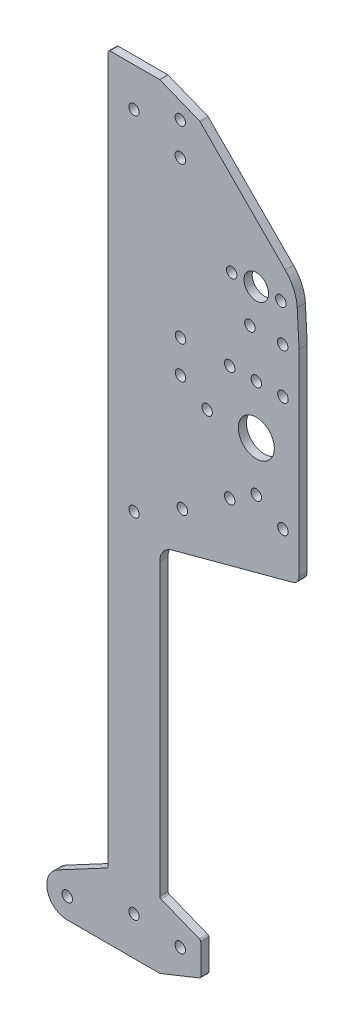
from build123d import *

# Parameters (mm, degrees)
SKETCH1_W               = 20
SKETCH1_H               = 300
BOSS_EXTRUDE1_DEPTH     = 3.175
SKETCH2_R               = 2
SKETCH2_R_2             = 2.032
BOSS_EXTRUDE2_DEPTH     = 3.175
SKETCH4_R               = 2
CUT_EXTRUDE1_DEPTH      = 153.248468794
SKETCH6_R               = 2.032
BOSS_EXTRUDE4_DEPTH     = 3.175
FILLET4_R               = 0.79375
SKETCH7_R               = 4.7625
SKETCH7_R_2             = 6.985
SKETCH7_R_3             = 2.032
BOSS_EXTRUDE5_DEPTH     = 3.175
SKETCH8_R               = 2.032
CUT_EXTRUDE2_DEPTH      = 164.103897102
CUT_EXTRUDE3_DEPTH      = 164.103897102
SKETCH10_R              = 2.032
CUT_EXTRUDE4_DEPTH      = 164.103897102
FILLET6_R               = 6.35
CUT_EXTRUDE5_DEPTH      = 164.103897102
CUT_EXTRUDE5_DEPTH_BACK = 164.103897102
SKETCH11_R              = 2
SKETCH12_R              = 2.032
BOSS_EXTRUDE6_DEPTH     = 3.175
FILLET7_R               = 0.79375


with BuildPart() as part:
    # Sketch1 → Boss-Extrude1 (new body)
    with BuildSketch(Plane.XY):
        Rectangle(SKETCH1_W, SKETCH1_H)
    extrude(amount=BOSS_EXTRUDE1_DEPTH)

    # Sketch2 → Boss-Extrude2 (add)
    # profile 1 of 2: a face of its own
    with BuildSketch(Plane.XY.offset(3.175)):
        Polygon((10, 150), (25.875, 143.65), (25.875, 124.6), (10, 118.25), align=None)
        with Locations((17.9375, 140.475)):
            Circle(SKETCH2_R, mode=Mode.SUBTRACT)
        with Locations((17.9375, 127.775)):
            Circle(SKETCH2_R_2, mode=Mode.SUBTRACT)
    # profile 2 of 2: a face of its own
    with BuildSketch(Plane.XY.offset(3.175)):
        Polygon((10, -118.25), (10, -150), (25.875, -143.65), (25.875, -124.6), align=None)
        with Locations((17.9375, -127.775)):
            Circle(SKETCH2_R, mode=Mode.SUBTRACT)
        with Locations((17.9375, -140.475)):
            Circle(SKETCH2_R, mode=Mode.SUBTRACT)
    extrude(amount=-BOSS_EXTRUDE2_DEPTH)

    # Sketch4 → Cut-Extrude1 (cut, through all)
    with BuildSketch(Plane.XY.offset(3.175)):
        with Locations((0, -135)):
            Circle(SKETCH4_R)
        Circle(SKETCH4_R)
        with Locations((0, 135)):
            Circle(SKETCH4_R)
    extrude(amount=-CUT_EXTRUDE1_DEPTH, mode=Mode.SUBTRACT)

    # Sketch6 → Boss-Extrude4 (add)
    with BuildSketch(Plane.XY.offset(3.175)):
        with BuildLine():
            Line((-10, -124.6), (-10, -150))
            Line((-10, -150), (-25.875, -150))
            ThreePointArc((-25.875, -150), (-33.575506095, -143.987626524), (-29.610294118, -135.058823529))
            Line((-29.610294118, -135.058823529), (-10, -124.6))
        make_face()
        with Locations((-25.875, -142.0625)):
            Circle(SKETCH6_R, mode=Mode.SUBTRACT)
    extrude(amount=-BOSS_EXTRUDE4_DEPTH)

    # Fillet4
    fillet4_edges = [part.edges().sort_by_distance(p)[0] for p in [
        (25.875, 124.6, 1.5875),
        (25.875, 143.65, 1.5875),
        (10, 118.25, 1.5875),
        (25.875, -143.65, 1.5875),
        (25.875, -124.6, 1.5875),
        (10, -118.25, 1.5875),
        (-10, -124.6, 1.5875),
        (-10, 150, 1.5875),
    ]]
    fillet(fillet4_edges, radius=FILLET4_R)

    # Sketch7 → Boss-Extrude5 (add)
    with BuildSketch(Plane(origin=(0, 0, 0), x_dir=(-1, 0, 0), z_dir=(0, 0, -1))):
        with BuildLine():
            Line((-25.533906668, 143.764633463), (-63.633906668, 117.314528376))
            ThreePointArc((-63.633906668, 117.314528376), (-63.884576131, 117.030428547), (-63.975, 116.6625))
            Line((-63.975, 116.6625), (-63.975, 10.1095))
            ThreePointArc((-63.975, 10.1095), (-63.318896855, 8.176682463), (-61.621750468, 7.042685502))
            Line((-61.621750468, 7.042685502), (-10, -6.789320848))
            Line((-10, -6.789320848), (-10, 117.712605087))
            ThreePointArc((-10, 117.712605087), (-10.136471636, 118.157604204), (-10.498958651, 118.44958346))
            Line((-10.498958651, 118.44958346), (-25.376041349, 124.40041654))
            ThreePointArc((-25.376041349, 124.40041654), (-25.738528364, 124.692395796), (-25.875, 125.137394913))
            Line((-25.875, 125.137394913), (-25.875, 143.112605087))
            ThreePointArc((-25.875, 143.112605087), (-25.784576131, 143.480533634), (-25.533906668, 143.764633463))
        make_face()
        with Locations((-47.4015, 99.2)):
            Circle(SKETCH7_R, mode=Mode.SUBTRACT)
        with Locations((-47.4015, 48.4)):
            Circle(SKETCH7_R_2, mode=Mode.SUBTRACT)
        with Locations((-57.72025, 67.45)):
            Circle(SKETCH7_R_3, mode=Mode.SUBTRACT)
        with Locations((-57.72025, 23)):
            Circle(SKETCH7_R_3, mode=Mode.SUBTRACT)
        with Locations((-37.08275, 23)):
            Circle(SKETCH7_R_3, mode=Mode.SUBTRACT)
        with Locations((-37.08275, 67.45)):
            Circle(SKETCH7_R_3, mode=Mode.SUBTRACT)
        with Locations((-18.73125, 10.3)):
            Circle(SKETCH7_R_3, mode=Mode.SUBTRACT)
    extrude(amount=-BOSS_EXTRUDE5_DEPTH)

    # Sketch8 → Cut-Extrude2 (cut, through all)
    with BuildSketch(Plane.XY.offset(3.175)):
        with Locations((47.4015, 67.45)):
            Circle(SKETCH8_R)
        with Locations((28.3515, 48.4)):
            Circle(SKETCH8_R)
        with Locations((47.4015, 29.35)):
            Circle(SKETCH8_R)
        with Locations((56.9265, 99.2)):
            Circle(SKETCH8_R)
        with Locations((37.8765, 99.2)):
            Circle(SKETCH8_R)
        with Locations((18.03275, 54.75)):
            Circle(SKETCH8_R)
        with Locations((18.03275, 67.45)):
            Circle(SKETCH8_R)
    extrude(amount=-CUT_EXTRUDE2_DEPTH, mode=Mode.SUBTRACT)

    # Sketch9 → Cut-Extrude3 (cut, through all)
    with BuildSketch(Plane(origin=(0, 0, 0), x_dir=(-1, 0, 0), z_dir=(0, 0, -1))):
        with BuildLine():
            Line((-25.644749354, 143.671628825), (-58.67148709, 110.380474766))
            ThreePointArc((-58.67148709, 110.380474766), (-61.914239932, 105.633972698), (-63.254057026, 100.043836919))
            Line((-63.254057026, 100.043836919), (-63.975, 86.5))
            Line((-63.975, 86.5), (-63.975, 116.6625))
            ThreePointArc((-63.975, 116.6625), (-63.884576131, 117.030428547), (-63.633906668, 117.314528376))
            Line((-63.633906668, 117.314528376), (-25.533906668, 143.764633463))
            ThreePointArc((-25.533906668, 143.764633463), (-25.591451658, 143.7206621), (-25.644749354, 143.671628825))
        make_face()
    extrude(amount=-CUT_EXTRUDE3_DEPTH, mode=Mode.SUBTRACT)

    # Sketch10 → Cut-Extrude4 (cut, through all)
    with BuildSketch(Plane(origin=(0, 0, 0), x_dir=(-1, 0, 0), z_dir=(0, 0, -1))):
        with Locations((-57.625, 84.9125)):
            Circle(SKETCH10_R)
        with Locations((-44.925, 84.9125)):
            Circle(SKETCH10_R)
    extrude(amount=-CUT_EXTRUDE4_DEPTH, mode=Mode.SUBTRACT)

    # Fillet6
    fillet6_edges = [part.edges().sort_by_distance(p)[0] for p in [
        (10, -6.789320848, 1.5875),
    ]]
    fillet(fillet6_edges, radius=FILLET6_R)

    # Sketch11 → Cut-Extrude5 (cut, two sides: drawn at the far end of the back side and taken through both)
    with BuildSketch(Plane.XY.offset(3.175).offset(-CUT_EXTRUDE5_DEPTH_BACK)):
        with BuildLine():
            ThreePointArc((10.498958651, -118.44958346), (10.136471636, -118.157604204), (10, -117.712605087))
            Line((10, -117.712605087), (10, -150))
            Line((10, -150), (25.376041349, -143.84958346))
            ThreePointArc((25.376041349, -143.84958346), (25.738528364, -143.557604204), (25.875, -143.112605087))
            Line((25.875, -143.112605087), (25.875, -125.137394913))
            ThreePointArc((25.875, -125.137394913), (25.738528364, -124.692395796), (25.376041349, -124.40041654))
            Line((25.376041349, -124.40041654), (10.498958651, -118.44958346))
        make_face()
        with Locations((17.9375, -140.475)):
            Circle(SKETCH11_R, mode=Mode.SUBTRACT)
        with Locations((17.9375, -127.775)):
            Circle(SKETCH11_R, mode=Mode.SUBTRACT)
    extrude(amount=CUT_EXTRUDE5_DEPTH + CUT_EXTRUDE5_DEPTH_BACK, mode=Mode.SUBTRACT)

    # Sketch12 → Boss-Extrude6 (add)
    with BuildSketch(Plane.XY.offset(3.175)):
        Polygon((10, -150), (25.875, -143.65), (25.875, -130.95), (10, -124.6), align=None)
        with Locations((17.9375, -137.3)):
            Circle(SKETCH12_R, mode=Mode.SUBTRACT)
    extrude(amount=-BOSS_EXTRUDE6_DEPTH)

    # Fillet7
    fillet7_edges = [part.edges().sort_by_distance(p)[0] for p in [
        (25.875, -143.65, 1.5875),
        (25.875, -130.95, 1.5875),
        (10, -124.6, 1.5875),
        (10, -150, 1.5875),
    ]]
    fillet(fillet7_edges, radius=FILLET7_R)


solid = part.part
